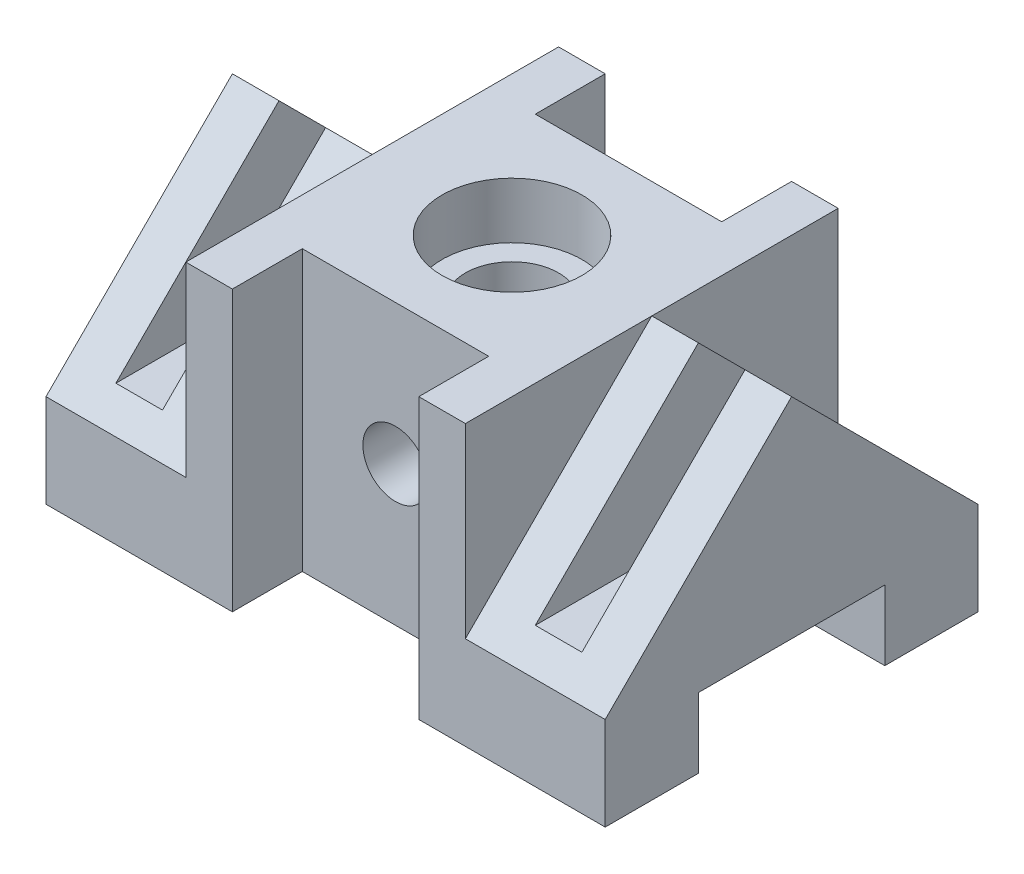
from build123d import *

# Parameters (mm, degrees)
BOSS_EXTRUDE1_DEPTH = 60
SKETCH3_W           = 30
SKETCH3_H           = 20
BOSS_EXTRUDE2_DEPTH = 80
SKETCH4_W           = 40
SKETCH4_H           = 15
CUT_EXTRUDE1_DEPTH  = 141.678348685
BOSS_EXTRUDE3_DEPTH = 30
BOSS_EXTRUDE4_DEPTH = 30
SKETCH8_W           = 10
SKETCH8_H           = 35
CUT_EXTRUDE2_DEPTH  = 61
SKETCH9_W           = 10
SKETCH9_H           = 35
CUT_EXTRUDE3_DEPTH  = 61
SKETCH10_R          = 7
CUT_EXTRUDE4_DEPTH  = 61
SKETCH12_R          = 10
CUT_EXTRUDE5_DEPTH  = 12
SKETCH13_R          = 15
CUT_EXTRUDE6_DEPTH  = 12


with BuildPart() as part:
    # Sketch1 → Boss-Extrude1 (new body)
    with BuildSketch(Plane(origin=(0, 0, 0), x_dir=(1, 0, 0), z_dir=(0, 1, 0))):
        Polygon((-7.906128035, 42.313092402), (-17.906128035, 42.313092402), (-17.906128035, -37.686907598), (-7.906128035, -37.686907598), (-7.906128035, -22.686907598), (32.093871965, -22.686907598), (32.093871965, -37.686907598), (42.093871965, -37.686907598), (42.093871965, 42.313092402), (32.093871965, 42.313092402), (32.093871965, 27.313092402), (-7.906128035, 27.313092402), align=None)
    extrude(amount=-BOSS_EXTRUDE1_DEPTH)

    # Sketch3 → Boss-Extrude2 (add)
    with BuildSketch(Plane.XY.offset(37.686907598)):
        with Locations((-32.906128035, -50)):
            Rectangle(SKETCH3_W, SKETCH3_H)
        with Locations((57.093871965, -50)):
            Rectangle(SKETCH3_W, SKETCH3_H)
    extrude(amount=-BOSS_EXTRUDE2_DEPTH)

    # Sketch4 → Cut-Extrude1 (cut, through all)
    with BuildSketch(Plane.ZY.offset(47.906128035)):
        with Locations((-2.313092402, -52.5)):
            Rectangle(SKETCH4_W, SKETCH4_H)
    extrude(amount=-CUT_EXTRUDE1_DEPTH, mode=Mode.SUBTRACT)

    # Sketch5 → Boss-Extrude3 (add)
    with BuildSketch(Plane.ZY.offset(47.906128035)):
        Polygon((-42.313092402, -40), (-2.313092402, 0), (37.686907598, -40), align=None)
    extrude(amount=-BOSS_EXTRUDE3_DEPTH)

    # Sketch6 → Boss-Extrude4 (add)
    with BuildSketch(Plane(origin=(72.093871965, 0, 0), x_dir=(0, 0, -1), z_dir=(1, 0, 0))):
        Polygon((-37.686907598, -40), (2.313092402, 0), (42.313092402, -40), align=None)
    extrude(amount=-BOSS_EXTRUDE4_DEPTH)

    # Sketch8 → Cut-Extrude2 (cut, symmetric)
    with BuildSketch(Plane.XY.offset(-2.313092402)):
        with Locations((-32.906128035, -17.5)):
            Rectangle(SKETCH8_W, SKETCH8_H)
    extrude(amount=CUT_EXTRUDE2_DEPTH, both=True, mode=Mode.SUBTRACT)

    # Sketch9 → Cut-Extrude3 (cut, symmetric)
    with BuildSketch(Plane.XY.offset(-2.313092402)):
        with Locations((57.093871965, -17.5)):
            Rectangle(SKETCH9_W, SKETCH9_H)
    extrude(amount=CUT_EXTRUDE3_DEPTH, both=True, mode=Mode.SUBTRACT)

    # Sketch10 → Cut-Extrude4 (cut, symmetric)
    with BuildSketch(Plane.XY.offset(22.686907598)):
        with Locations((12.093871965, -30)):
            Circle(SKETCH10_R)
    extrude(amount=CUT_EXTRUDE4_DEPTH, both=True, mode=Mode.SUBTRACT)

    # Sketch12 → Cut-Extrude5 (cut)
    with BuildSketch(Plane(origin=(0, -10, 0), x_dir=(1, 0, 0), z_dir=(0, 1, 0))):
        with Locations(Location((12.093871965, 2.313092402, 0), (0, 0, 270))):
            Circle(SKETCH12_R)
    extrude(amount=-CUT_EXTRUDE5_DEPTH, mode=Mode.SUBTRACT)

    # Sketch13 → Cut-Extrude6 (cut)
    with BuildSketch(Plane(origin=(0, 0, 0), x_dir=(1, 0, 0), z_dir=(0, 1, 0))):
        with Locations(Location((12.093871965, 2.313092402, 0), (0, 0, 270))):
            Circle(SKETCH13_R)
    extrude(amount=-CUT_EXTRUDE6_DEPTH, mode=Mode.SUBTRACT)


solid = part.part
